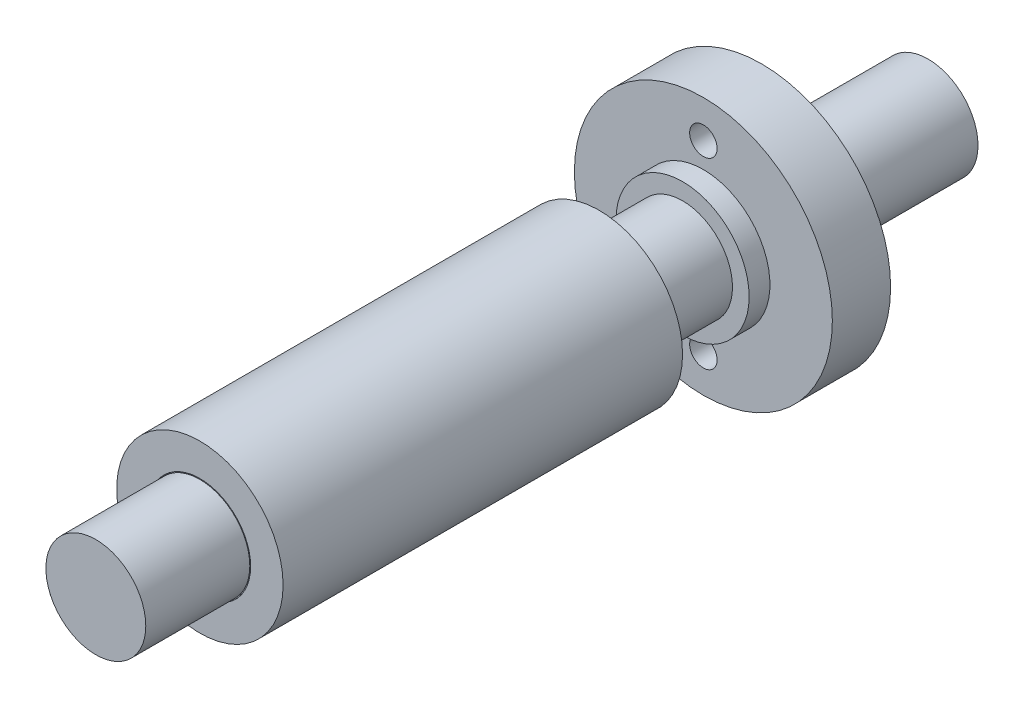
from build123d import *

# Parameters (mm, degrees)
SKETCH1_R           = 6
BOSS_EXTRUDE1_DEPTH = 100
SKETCH2_R           = 15.5
BOSS_EXTRUDE2_DEPTH = 7
SKETCH3_R           = 8
BOSS_EXTRUDE3_DEPTH = 2.5
SKETCH4_R           = 10
BOSS_EXTRUDE4_DEPTH = 48
SKETCH5_R           = 1.65
CUT_EXTRUDE1_DEPTH  = 48
CUT_EXTRUDE2_START  = -48
SKETCH6_R           = 6.1
SKETCH6_R_2         = 6
CUT_EXTRUDE2_DEPTH  = 48
SKETCH7_R           = 6
SKETCH7_R_2         = 5.25
CUT_EXTRUDE3_DEPTH  = 1
SKETCH8_R           = 6
SKETCH8_R_2         = 5.25
CUT_EXTRUDE4_DEPTH  = 1


with BuildPart() as part:
    # Sketch1 → Boss-Extrude1 (new body)
    with BuildSketch(Plane.XY):
        Circle(SKETCH1_R)
    extrude(amount=BOSS_EXTRUDE1_DEPTH)

    # Sketch2 → Boss-Extrude2 (add)
    with BuildSketch(Plane(origin=(0, 0, 20), x_dir=(-1, 0, 0), z_dir=(0, 0, -1))):
        Circle(SKETCH2_R)
    extrude(amount=-BOSS_EXTRUDE2_DEPTH)

    # Sketch3 → Boss-Extrude3 (add)
    with BuildSketch(Plane.XY.offset(27)):
        with Locations(Location((0, 0, 0), (0, 0, 180))):
            Circle(SKETCH3_R)
    extrude(amount=BOSS_EXTRUDE3_DEPTH)

    # Sketch4 → Boss-Extrude4 (add)
    with BuildSketch(Plane.XY.offset(39.5)):
        Circle(SKETCH4_R)
    extrude(amount=BOSS_EXTRUDE4_DEPTH)

    # Sketch5 → Cut-Extrude1 (cut)
    with BuildSketch(Plane.XY.offset(27)):
        with Locations((0, 11)):
            Circle(SKETCH5_R)
        with Locations((0, -11)):
            Circle(SKETCH5_R)
    extrude(amount=-CUT_EXTRUDE1_DEPTH, mode=Mode.SUBTRACT)

    # Sketch6 → Cut-Extrude2 (cut)
    with BuildSketch(Plane.XY.offset(87.5).offset(CUT_EXTRUDE2_START)):
        Circle(SKETCH6_R)
        with Locations(Location((0, 0, 0), (0, 0, 180))):
            Circle(SKETCH6_R_2, mode=Mode.SUBTRACT)
    extrude(amount=CUT_EXTRUDE2_DEPTH, mode=Mode.SUBTRACT)


with BuildPart() as cut_extrude2_piece_1:
    # of the separate pieces the step leaves, piece 1, a body of its own (cut_extrude2_pieces)
    add(part.part.solids().sort_by_distance((6, 0, 0))[0])

    # Sketch7 → Cut-Extrude3 (cut)
    with BuildSketch(Plane.XY.offset(39.5)):
        Circle(SKETCH7_R)
        Circle(SKETCH7_R_2, mode=Mode.SUBTRACT)
    extrude(amount=CUT_EXTRUDE3_DEPTH, mode=Mode.SUBTRACT)

    # Sketch8 → Cut-Extrude4 (cut)
    with BuildSketch(Plane.XY.offset(87.5)):
        Circle(SKETCH8_R)
        Circle(SKETCH8_R_2, mode=Mode.SUBTRACT)
    extrude(amount=-CUT_EXTRUDE4_DEPTH, mode=Mode.SUBTRACT)


with BuildPart() as cut_extrude2_piece_2:
    # of the separate pieces the step leaves, piece 2, a body of its own (cut_extrude2_pieces)
    add(part.part.solids().sort_by_distance((10, 0, 39.5))[0])


solid = Compound([cut_extrude2_piece_1.part, cut_extrude2_piece_2.part])
